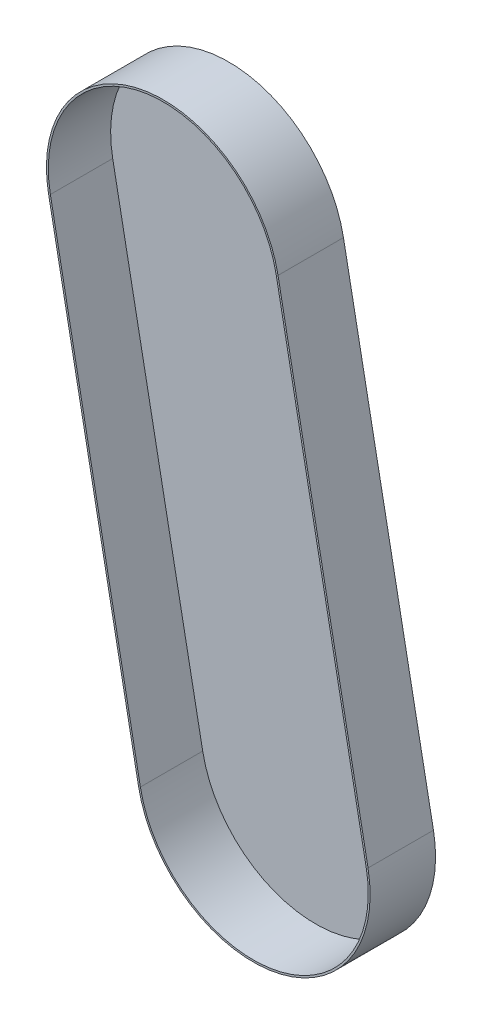
from build123d import *

# Parameters (mm, degrees)
BOSS_EXTRUDE1_DEPTH = 2
BOSS_EXTRUDE2_DEPTH = 40


with BuildPart() as part:
    # Sketch1 → Boss-Extrude1 (new body)
    with BuildSketch(Plane.XY):
        with BuildLine():
            Line((-24.797181948, 233.66326175), (32.965816351, -66.856045841))
            ThreePointArc((32.965816351, -66.856045841), (-26.529334007, -154.66451402), (-114.337802185, -95.169363662))
            Line((-114.337802185, -95.169363662), (-172.100800485, 205.34994393))
            ThreePointArc((-172.100800485, 205.34994393), (-112.605650127, 293.158412108), (-24.797181948, 233.66326175))
        make_face()
    extrude(amount=BOSS_EXTRUDE1_DEPTH)

    # Sketch2 → Boss-Extrude2 (add)
    with BuildSketch(Plane.XY.offset(2)):
        with BuildLine():
            Line((-24.797181948, 233.66326175), (32.965816351, -66.856045841))
            ThreePointArc((32.965816351, -66.856045841), (-26.529334007, -154.66451402), (-114.337802185, -95.169363662))
            Line((-114.337802185, -95.169363662), (-172.100800485, 205.34994393))
            ThreePointArc((-172.100800485, 205.34994393), (-112.605650127, 293.158412108), (-24.797181948, 233.66326175))
        make_face()
        with BuildLine():
            Line((-25.975610897, 233.436755208), (31.787387403, -67.082552384))
            ThreePointArc((31.787387403, -67.082552384), (-26.755840549, -153.486085072), (-113.159373237, -94.942857119))
            Line((-113.159373237, -94.942857119), (-170.922371537, 205.576450472))
            ThreePointArc((-170.922371537, 205.576450472), (-112.379143584, 291.97998316), (-25.975610897, 233.436755208))
        make_face(mode=Mode.SUBTRACT)
    extrude(amount=BOSS_EXTRUDE2_DEPTH)


solid = part.part
